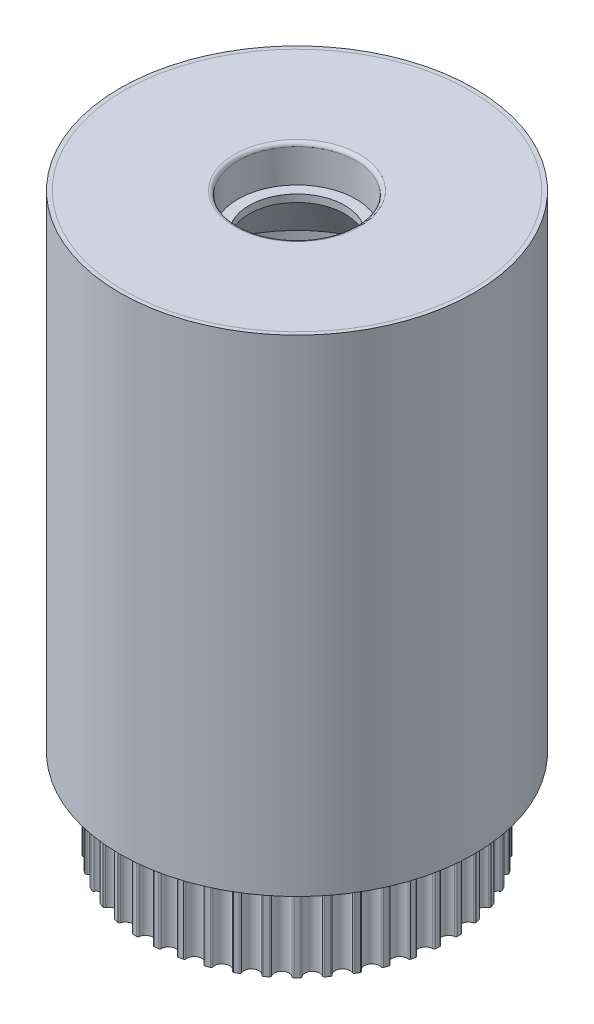
from build123d import *

# Parameters (mm, degrees)
FILLET1_R           = 0.5
SKETCH3_R           = 1
CUT_EXTRUDE1_DEPTH  = 12
FILLET2_R           = 0.2
SKETCH4_R           = 24.05
SKETCH4_R_2         = 23.5
BOSS_EXTRUDE1_DEPTH = 66


with BuildPart() as part:
    # Sketch1 → Revolve1 (revolve)
    with BuildSketch(Plane.XY, mode=Mode.PRIVATE) as revolve1_sk:
        Polygon((8, 78), (23.5, 78), (23.5, 12), (20.625, 12), (20.625, 0), (8, 0), (8, 5), (6.5, 5), (6.5, 10), (10, 10), (16, 15), (16, 62), (10.5, 72), (6.5, 72), (6.5, 73), (8, 73), align=None)
    revolve(revolve1_sk.sketch.rotate(Axis((0, 126.654886259, 0), (0, -1, 0)), 90), axis=Axis((0, 126.654886259, 0), (0, -1, 0)))

    # Fillet1
    fillet1_edges = [part.edges().sort_by_distance(p)[0] for p in [
        (0, 78, -8),
        (0, 0, -8),
    ]]
    fillet(fillet1_edges, radius=FILLET1_R)

    # Sketch3 → Cut-Extrude1 (cut)
    with BuildSketch(Plane.XZ):
        with Locations((0, 20.575)):
            Circle(SKETCH3_R)
        with Locations((2.928127797, 20.365576167)):
            Circle(SKETCH3_R)
        with Locations((5.796647357, 19.741567932)):
            Circle(SKETCH3_R)
        with Locations((8.547163893, 18.715678304)):
            Circle(SKETCH3_R)
        with Locations((11.123684819, 17.308791438)):
            Circle(SKETCH3_R)
        with Locations((13.473759601, 15.549547492)):
            Circle(SKETCH3_R)
        with Locations((15.549547492, 13.473759601)):
            Circle(SKETCH3_R)
        with Locations((17.308791438, 11.123684819)):
            Circle(SKETCH3_R)
        with Locations((18.715678304, 8.547163893)):
            Circle(SKETCH3_R)
        with Locations((19.741567932, 5.796647357)):
            Circle(SKETCH3_R)
        with Locations((20.365576167, 2.928127797)):
            Circle(SKETCH3_R)
        with Locations((20.575, 0)):
            Circle(SKETCH3_R)
        with Locations((20.365576167, -2.928127797)):
            Circle(SKETCH3_R)
        with Locations((19.741567932, -5.796647357)):
            Circle(SKETCH3_R)
        with Locations((18.715678304, -8.547163893)):
            Circle(SKETCH3_R)
        with Locations((17.308791438, -11.123684819)):
            Circle(SKETCH3_R)
        with Locations((15.549547492, -13.473759601)):
            Circle(SKETCH3_R)
        with Locations((13.473759601, -15.549547492)):
            Circle(SKETCH3_R)
        with Locations((11.123684819, -17.308791438)):
            Circle(SKETCH3_R)
        with Locations((8.547163893, -18.715678304)):
            Circle(SKETCH3_R)
        with Locations((5.796647357, -19.741567932)):
            Circle(SKETCH3_R)
        with Locations((2.928127797, -20.365576167)):
            Circle(SKETCH3_R)
        with Locations((0, -20.575)):
            Circle(SKETCH3_R)
        with Locations((-2.928127797, -20.365576167)):
            Circle(SKETCH3_R)
        with Locations((-5.796647357, -19.741567932)):
            Circle(SKETCH3_R)
        with Locations((-8.547163893, -18.715678304)):
            Circle(SKETCH3_R)
        with Locations((-11.123684819, -17.308791438)):
            Circle(SKETCH3_R)
        with Locations((-13.473759601, -15.549547492)):
            Circle(SKETCH3_R)
        with Locations((-15.549547492, -13.473759601)):
            Circle(SKETCH3_R)
        with Locations((-17.308791438, -11.123684819)):
            Circle(SKETCH3_R)
        with Locations((-18.715678304, -8.547163893)):
            Circle(SKETCH3_R)
        with Locations((-19.741567932, -5.796647357)):
            Circle(SKETCH3_R)
        with Locations((-20.365576167, -2.928127797)):
            Circle(SKETCH3_R)
        with Locations((-20.575, 0)):
            Circle(SKETCH3_R)
        with Locations((-20.365576167, 2.928127797)):
            Circle(SKETCH3_R)
        with Locations((-19.741567932, 5.796647357)):
            Circle(SKETCH3_R)
        with Locations((-18.715678304, 8.547163893)):
            Circle(SKETCH3_R)
        with Locations((-17.308791438, 11.123684819)):
            Circle(SKETCH3_R)
        with Locations((-15.549547492, 13.473759601)):
            Circle(SKETCH3_R)
        with Locations((-13.473759601, 15.549547492)):
            Circle(SKETCH3_R)
        with Locations((-11.123684819, 17.308791438)):
            Circle(SKETCH3_R)
        with Locations((-8.547163893, 18.715678304)):
            Circle(SKETCH3_R)
        with Locations((-5.796647357, 19.741567932)):
            Circle(SKETCH3_R)
        with Locations((-2.928127797, 20.365576167)):
            Circle(SKETCH3_R)
    extrude(amount=-CUT_EXTRUDE1_DEPTH, mode=Mode.SUBTRACT)

    # Fillet2
    fillet2_edges = [part.edges().sort_by_distance(p)[0] for p in [
        (-20.533341004, 6, -1.942300754),
        (-20.248805776, 6, -3.921286735),
        (-20.047922981, 6, -4.844730037),
        (-19.484644842, 6, -6.76307921),
        (-19.15438706, 6, -7.648534588),
        (-18.323832728, 6, -9.467194894),
        (-17.870923056, 6, -10.296637031),
        (-16.790000221, 6, -11.978585792),
        (-16.223658593, 6, -12.735129637),
        (-14.914371728, 6, -14.246127226),
        (-14.246127226, 6, -14.914371728),
        (-12.735129637, 6, -16.223658593),
        (-11.978585792, 6, -16.790000221),
        (-10.296637031, 6, -17.870923056),
        (-9.467194894, 6, -18.323832728),
        (-7.648534588, 6, -19.15438706),
        (-6.76307921, 6, -19.484644842),
        (-4.844730037, 6, -20.047922981),
        (-3.921286735, 6, -20.248805776),
        (-1.942300754, 6, -20.533341004),
        (-0.999668171, 6, -20.600759417),
        (0.999668171, 6, -20.600759417),
        (1.942300754, 6, -20.533341004),
        (3.921286735, 6, -20.248805776),
        (4.844730037, 6, -20.047922981),
        (6.76307921, 6, -19.484644842),
        (7.648534588, 6, -19.15438706),
        (9.467194894, 6, -18.323832728),
        (10.296637031, 6, -17.870923056),
        (11.978585792, 6, -16.790000221),
        (12.735129637, 6, -16.223658593),
        (14.246127226, 6, -14.914371728),
        (14.914371728, 6, -14.246127226),
        (16.223658593, 6, -12.735129637),
        (16.790000221, 6, -11.978585792),
        (17.870923056, 6, -10.296637031),
        (18.323832728, 6, -9.467194894),
        (19.15438706, 6, -7.648534588),
        (19.484644842, 6, -6.76307921),
        (20.047922981, 6, -4.844730037),
        (20.248805776, 6, -3.921286735),
        (20.533341004, 6, -1.942300754),
        (20.600759417, 6, -0.999668171),
        (20.600759417, 6, 0.999668171),
        (20.533341004, 6, 1.942300754),
        (20.248805776, 6, 3.921286735),
        (20.047922981, 6, 4.844730037),
        (19.484644842, 6, 6.76307921),
        (19.15438706, 6, 7.648534588),
        (18.323832728, 6, 9.467194894),
        (17.870923056, 6, 10.296637031),
        (16.790000221, 6, 11.978585792),
        (16.223658593, 6, 12.735129637),
        (14.914371728, 6, 14.246127226),
        (14.246127226, 6, 14.914371728),
        (12.735129637, 6, 16.223658593),
        (11.978585792, 6, 16.790000221),
        (10.296637031, 6, 17.870923056),
        (9.467194894, 6, 18.323832728),
        (7.648534588, 6, 19.15438706),
        (6.76307921, 6, 19.484644842),
        (4.844730037, 6, 20.047922981),
        (3.921286735, 6, 20.248805776),
        (1.942300754, 6, 20.533341004),
        (-20.600759417, 6, 0.999668171),
        (-20.600759417, 6, -0.999668171),
        (-20.248805776, 6, 3.921286735),
        (-20.533341004, 6, 1.942300754),
        (-19.484644842, 6, 6.76307921),
        (-20.047922981, 6, 4.844730037),
        (-18.323832728, 6, 9.467194894),
        (-19.15438706, 6, 7.648534588),
        (-16.790000221, 6, 11.978585792),
        (-17.870923056, 6, 10.296637031),
        (-14.914371728, 6, 14.246127226),
        (-16.223658593, 6, 12.735129637),
        (-12.735129637, 6, 16.223658593),
        (-14.246127226, 6, 14.914371728),
        (-10.296637031, 6, 17.870923056),
        (-11.978585792, 6, 16.790000221),
        (-7.648534588, 6, 19.15438706),
        (-9.467194894, 6, 18.323832728),
        (-4.844730037, 6, 20.047922981),
        (-6.76307921, 6, 19.484644842),
        (-1.942300754, 6, 20.533341004),
        (-3.921286735, 6, 20.248805776),
        (0.999668171, 6, 20.600759417),
        (-0.999668171, 6, 20.600759417),
    ]]
    fillet(fillet2_edges, radius=FILLET2_R)


with BuildPart() as body_2:
    # Sketch4 → Boss-Extrude1 (new body)
    with BuildSketch(Plane(origin=(0, 78, 0), x_dir=(1, 0, 0), z_dir=(0, 1, 0))):
        with Locations(Location((0, 0, 0), (0, 0, 270))):
            Circle(SKETCH4_R)
        with Locations(Location((0, 0, 0), (0, 0, 270))):
            Circle(SKETCH4_R_2, mode=Mode.SUBTRACT)
    extrude(amount=-BOSS_EXTRUDE1_DEPTH)


solid = Compound([part.part, body_2.part])
